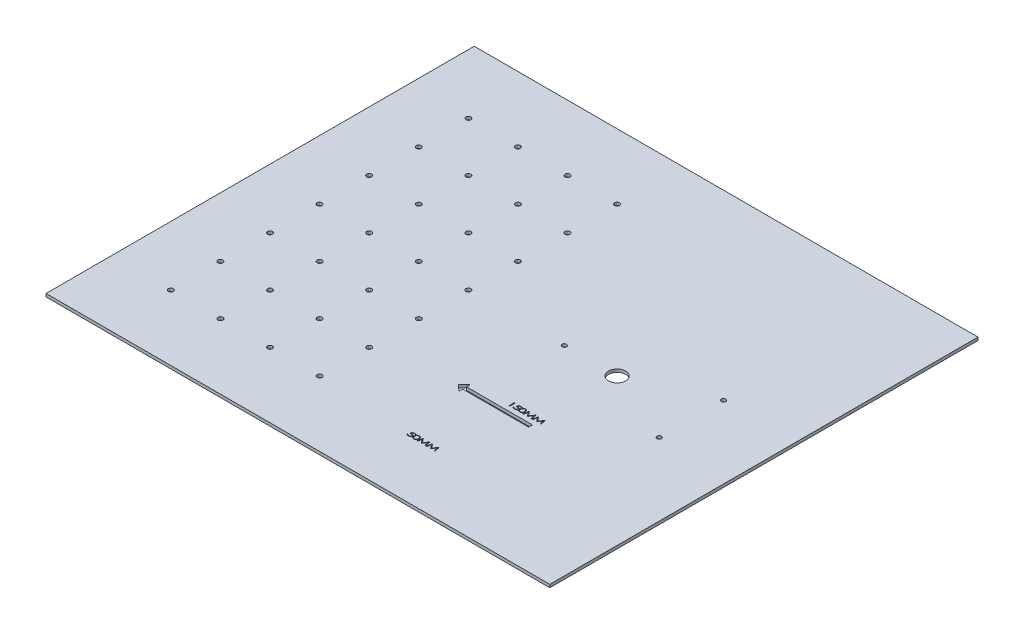
from build123d import *

# Parameters (mm, degrees)
SKETCH1_W                = 508
SKETCH1_H                = 431.8
BOSS_EXTRUDE1_DEPTH      = 3
SKETCH3_R                = 2.25
SKETCH3_R_2              = 8.65
CUT_EXTRUDE1_DEPTH       = 334.373379261
SKETCH4_R                = 2.5
CUT_EXTRUDE2_DEPTH       = 334.373379261
LPATTERN1_COUNT          = 4
LPATTERN1_PITCH          = 50
LPATTERN1_COUNT_DIR2     = 4
LPATTERN1_PITCH_DIR2     = 50
MIRROR1_COPY_1_SKETCH_R  = 2.5
MIRROR1_COPY_1_DEPTH     = 334.373379261
MIRROR1_COPY_2_SKETCH_R  = 2.5
MIRROR1_COPY_2_DEPTH     = 334.373379261
MIRROR1_COPY_3_SKETCH_R  = 2.5
MIRROR1_COPY_3_DEPTH     = 334.373379261
MIRROR1_COPY_4_SKETCH_R  = 2.5
MIRROR1_COPY_4_DEPTH     = 334.373379261
MIRROR1_COPY_5_SKETCH_R  = 2.5
MIRROR1_COPY_5_DEPTH     = 334.373379261
MIRROR1_COPY_6_SKETCH_R  = 2.5
MIRROR1_COPY_6_DEPTH     = 334.373379261
MIRROR1_COPY_7_SKETCH_R  = 2.5
MIRROR1_COPY_7_DEPTH     = 334.373379261
MIRROR1_COPY_8_SKETCH_R  = 2.5
MIRROR1_COPY_8_DEPTH     = 334.373379261
MIRROR1_COPY_9_SKETCH_R  = 2.5
MIRROR1_COPY_9_DEPTH     = 334.373379261
MIRROR1_COPY_10_SKETCH_R = 2.5
MIRROR1_COPY_10_DEPTH    = 334.373379261
MIRROR1_COPY_11_SKETCH_R = 2.5
MIRROR1_COPY_11_DEPTH    = 334.373379261
MIRROR1_COPY_12_SKETCH_R = 2.5
MIRROR1_COPY_12_DEPTH    = 334.373379261
MIRROR1_COPY_13_SKETCH_R = 2.5
MIRROR1_COPY_13_DEPTH    = 334.373379261
MIRROR1_COPY_14_SKETCH_R = 2.5
MIRROR1_COPY_14_DEPTH    = 334.373379261
MIRROR1_COPY_15_SKETCH_R = 2.5
MIRROR1_COPY_15_DEPTH    = 334.373379261
MIRROR1_COPY_16_SKETCH_R = 2.5
MIRROR1_COPY_16_DEPTH    = 334.373379261
CUT_EXTRUDE3_DEPTH       = 334.373379261


with BuildPart() as part:
    # Sketch1 → Boss-Extrude1 (new body)
    with BuildSketch(Plane(origin=(0, 0, 0), x_dir=(1, 0, 0), z_dir=(0, 1, 0))):
        Rectangle(SKETCH1_W, SKETCH1_H)
    extrude(amount=BOSS_EXTRUDE1_DEPTH)

    # Sketch3 → Cut-Extrude1 (cut, through all)
    with BuildSketch(Plane(origin=(0, 3, 0), x_dir=(1, 0, 0), z_dir=(0, 1, 0))):
        with Locations(Location((180.936115746, -32.430740144, 0), (0, 0, 270))):
            Circle(SKETCH3_R)
        with Locations(Location((180.936115746, 32.430740144, 0), (0, 0, 270))):
            Circle(SKETCH3_R)
        with Locations(Location((52.812916669, 0, 0), (0, 0, 270))):
            Circle(SKETCH3_R)
        with Locations(Location((106, 0, 0), (0, 0, 270))):
            Circle(SKETCH3_R_2)
    extrude(amount=-CUT_EXTRUDE1_DEPTH, mode=Mode.SUBTRACT)

    # Sketch4 → Cut-Extrude2 (cut, through all)
    with BuildSketch(Plane(origin=(0, 3, 0), x_dir=(1, 0, 0), z_dir=(0, 1, 0))):
        with Locations(Location((-44, 0, 0), (0, 0, 270))):
            Circle(SKETCH4_R)
    cut_extrude2 = extrude(amount=-CUT_EXTRUDE2_DEPTH, mode=Mode.SUBTRACT)

    # LPattern1: Cut-Extrude2 4 × 4
    with Locations(*[(-j * LPATTERN1_PITCH_DIR2, 0, -i * LPATTERN1_PITCH) for i in range(LPATTERN1_COUNT) for j in range(LPATTERN1_COUNT_DIR2) if (i, j) != (0, 0)]):
        add(cut_extrude2, mode=Mode.SUBTRACT)

    # Mirror1 copy 1 sketch → Mirror1 copy 1 (cut, through all)
    with BuildSketch(Plane(origin=(-50, 3, 0), x_dir=(1, 0, 0), z_dir=(0, 1, 0))):
        with Locations((-44, 0)):
            Circle(MIRROR1_COPY_1_SKETCH_R)
    extrude(amount=-MIRROR1_COPY_1_DEPTH, mode=Mode.SUBTRACT)

    # Mirror1 copy 2 sketch → Mirror1 copy 2 (cut, through all)
    with BuildSketch(Plane(origin=(-100, 3, 0), x_dir=(1, 0, 0), z_dir=(0, 1, 0))):
        with Locations((-44, 0)):
            Circle(MIRROR1_COPY_2_SKETCH_R)
    extrude(amount=-MIRROR1_COPY_2_DEPTH, mode=Mode.SUBTRACT)

    # Mirror1 copy 3 sketch → Mirror1 copy 3 (cut, through all)
    with BuildSketch(Plane(origin=(-150, 3, 0), x_dir=(1, 0, 0), z_dir=(0, 1, 0))):
        with Locations((-44, 0)):
            Circle(MIRROR1_COPY_3_SKETCH_R)
    extrude(amount=-MIRROR1_COPY_3_DEPTH, mode=Mode.SUBTRACT)

    # Mirror1 copy 4 sketch → Mirror1 copy 4 (cut, through all)
    with BuildSketch(Plane(origin=(0, 3, 50), x_dir=(1, 0, 0), z_dir=(0, 1, 0))):
        with Locations((-44, 0)):
            Circle(MIRROR1_COPY_4_SKETCH_R)
    extrude(amount=-MIRROR1_COPY_4_DEPTH, mode=Mode.SUBTRACT)

    # Mirror1 copy 5 sketch → Mirror1 copy 5 (cut, through all)
    with BuildSketch(Plane(origin=(-50, 3, 50), x_dir=(1, 0, 0), z_dir=(0, 1, 0))):
        with Locations((-44, 0)):
            Circle(MIRROR1_COPY_5_SKETCH_R)
    extrude(amount=-MIRROR1_COPY_5_DEPTH, mode=Mode.SUBTRACT)

    # Mirror1 copy 6 sketch → Mirror1 copy 6 (cut, through all)
    with BuildSketch(Plane(origin=(-100, 3, 50), x_dir=(1, 0, 0), z_dir=(0, 1, 0))):
        with Locations((-44, 0)):
            Circle(MIRROR1_COPY_6_SKETCH_R)
    extrude(amount=-MIRROR1_COPY_6_DEPTH, mode=Mode.SUBTRACT)

    # Mirror1 copy 7 sketch → Mirror1 copy 7 (cut, through all)
    with BuildSketch(Plane(origin=(-150, 3, 50), x_dir=(1, 0, 0), z_dir=(0, 1, 0))):
        with Locations((-44, 0)):
            Circle(MIRROR1_COPY_7_SKETCH_R)
    extrude(amount=-MIRROR1_COPY_7_DEPTH, mode=Mode.SUBTRACT)

    # Mirror1 copy 8 sketch → Mirror1 copy 8 (cut, through all)
    with BuildSketch(Plane(origin=(0, 3, 100), x_dir=(1, 0, 0), z_dir=(0, 1, 0))):
        with Locations((-44, 0)):
            Circle(MIRROR1_COPY_8_SKETCH_R)
    extrude(amount=-MIRROR1_COPY_8_DEPTH, mode=Mode.SUBTRACT)

    # Mirror1 copy 9 sketch → Mirror1 copy 9 (cut, through all)
    with BuildSketch(Plane(origin=(-50, 3, 100), x_dir=(1, 0, 0), z_dir=(0, 1, 0))):
        with Locations((-44, 0)):
            Circle(MIRROR1_COPY_9_SKETCH_R)
    extrude(amount=-MIRROR1_COPY_9_DEPTH, mode=Mode.SUBTRACT)

    # Mirror1 copy 10 sketch → Mirror1 copy 10 (cut, through all)
    with BuildSketch(Plane(origin=(-100, 3, 100), x_dir=(1, 0, 0), z_dir=(0, 1, 0))):
        with Locations((-44, 0)):
            Circle(MIRROR1_COPY_10_SKETCH_R)
    extrude(amount=-MIRROR1_COPY_10_DEPTH, mode=Mode.SUBTRACT)

    # Mirror1 copy 11 sketch → Mirror1 copy 11 (cut, through all)
    with BuildSketch(Plane(origin=(-150, 3, 100), x_dir=(1, 0, 0), z_dir=(0, 1, 0))):
        with Locations((-44, 0)):
            Circle(MIRROR1_COPY_11_SKETCH_R)
    extrude(amount=-MIRROR1_COPY_11_DEPTH, mode=Mode.SUBTRACT)

    # Mirror1 copy 12 sketch → Mirror1 copy 12 (cut, through all)
    with BuildSketch(Plane(origin=(0, 3, 150), x_dir=(1, 0, 0), z_dir=(0, 1, 0))):
        with Locations((-44, 0)):
            Circle(MIRROR1_COPY_12_SKETCH_R)
    extrude(amount=-MIRROR1_COPY_12_DEPTH, mode=Mode.SUBTRACT)

    # Mirror1 copy 13 sketch → Mirror1 copy 13 (cut, through all)
    with BuildSketch(Plane(origin=(-50, 3, 150), x_dir=(1, 0, 0), z_dir=(0, 1, 0))):
        with Locations((-44, 0)):
            Circle(MIRROR1_COPY_13_SKETCH_R)
    extrude(amount=-MIRROR1_COPY_13_DEPTH, mode=Mode.SUBTRACT)

    # Mirror1 copy 14 sketch → Mirror1 copy 14 (cut, through all)
    with BuildSketch(Plane(origin=(-100, 3, 150), x_dir=(1, 0, 0), z_dir=(0, 1, 0))):
        with Locations((-44, 0)):
            Circle(MIRROR1_COPY_14_SKETCH_R)
    extrude(amount=-MIRROR1_COPY_14_DEPTH, mode=Mode.SUBTRACT)

    # Mirror1 copy 15 sketch → Mirror1 copy 15 (cut, through all)
    with BuildSketch(Plane(origin=(-150, 3, 150), x_dir=(1, 0, 0), z_dir=(0, 1, 0))):
        with Locations((-44, 0)):
            Circle(MIRROR1_COPY_15_SKETCH_R)
    extrude(amount=-MIRROR1_COPY_15_DEPTH, mode=Mode.SUBTRACT)

    # Mirror1 copy 16 sketch → Mirror1 copy 16 (cut, through all)
    with BuildSketch(Plane(origin=(0, 3, 0), x_dir=(1, 0, 0), z_dir=(0, 1, 0))):
        with Locations((-44, 0)):
            Circle(MIRROR1_COPY_16_SKETCH_R)
    extrude(amount=-MIRROR1_COPY_16_DEPTH, mode=Mode.SUBTRACT)

    # Sketch5 → Cut-Extrude3 (cut, through all)
    # profile 1 of 10: a face of its own
    with BuildSketch(Plane(origin=(0, 3, 0), x_dir=(1, 0, 0), z_dir=(0, 1, 0))):
        Polygon((106, -85.434687604), (39.587582854, -85.434687604), (39.587582854, -81.781861558), (33.181549807, -87.362208873), (39.587582854, -92.942556188), (39.587582854, -89.289730142), (106, -89.289730142), align=None)
    # profile 2 of 10: a face of its own
    with BuildSketch(Plane(origin=(0, 3, 0), x_dir=(1, 0, 0), z_dir=(0, 1, 0))):
        Polygon((76.805592119, -75.174104307), (78.307653751, -75.174104307), (78.307653751, -80.465770973), (77.561393067, -80.465770973), (77.561393067, -75.71683935), (76.340239221, -75.71683935), align=None)
    # profile 3 of 10: a face of its own
    with BuildSketch(Plane(origin=(0, 3, 0), x_dir=(1, 0, 0), z_dir=(0, 1, 0))):
        with BuildLine():
            Line((85.444619563, -75.174104307), (85.444619563, -75.71683935))
            Line((85.444619563, -75.71683935), (82.851787699, -75.71683935))
            Line((82.851787699, -75.71683935), (82.42141577, -77.115018102))
            add(Edge.make_bspline(
                [(82.42141577, -77.115018102), (82.502176069, -77.098233974), (82.659183031, -77.065603769), (82.89037466, -77.032679424), (83.108893952, -77.009274638), (83.250655477, -77.006956792), (83.319260656, -77.005835076)],
                knots=[0, 0, 0, 0, 1.092118873, 2.123200014, 3.091726778, 4, 4, 4, 4], degree=3))
            add(Edge.make_bspline(
                [(83.319260656, -77.005835076), (83.404475853, -77.007082747), (83.571001681, -77.00952092), (83.814967085, -77.033764907), (84.047720512, -77.071485542), (84.269292681, -77.124204462), (84.479489729, -77.191829672), (84.677397342, -77.276321871), (84.864890599, -77.374604986), (85.038778202, -77.488750232), (85.19682443, -77.61377353), (85.336730835, -77.747300692), (85.452426342, -77.89181626), (85.549667908, -78.04320536), (85.624197521, -78.204525401), (85.677328937, -78.374448872), (85.710171211, -78.552919348), (85.714027546, -78.674887039), (85.715987085, -78.736863054)],
                knots=[0, 0, 0, 0, 1.242117267, 2.427320619, 3.570715956, 4.677834446, 5.74496214, 6.786054724, 7.811581669, 8.827539835, 9.813966018, 10.74666266, 11.64056272, 12.506685079, 13.364137757, 14.222827697, 15.096957098, 16, 16, 16, 16], degree=3))
            add(Edge.make_bspline(
                [(85.715987085, -78.736863054), (85.715074659, -78.780031216), (85.713257584, -78.865999699), (85.695370645, -78.993270385), (85.668125209, -79.118280658), (85.628527109, -79.240164045), (85.578553647, -79.359310779), (85.517665459, -79.475684685), (85.445184932, -79.589398304), (85.361826775, -79.699599885), (85.269743993, -79.80586396), (85.168733666, -79.905371573), (85.060359802, -79.998837186), (84.944388269, -80.086236286), (84.820150662, -80.166507234), (84.688243937, -80.241102896), (84.548221935, -80.308669632), (84.400597646, -80.370041706), (84.246570901, -80.425362791), (84.085862404, -80.471308872), (83.920183183, -80.51215005), (83.748187556, -80.544741786), (83.56991821, -80.570282239), (83.385588637, -80.587572543), (83.195767454, -80.600287902), (83.067349195, -80.60106246), (83.002311871, -80.601454734)],
                knots=[0, 0, 0, 0, 0.849737757, 1.692234802, 2.526325876, 3.367039004, 4.212319464, 5.068331996, 5.950617473, 6.865060235, 7.787491851, 8.71755737, 9.655065502, 10.604304333, 11.575234203, 12.566184335, 13.587081016, 14.635246973, 15.713814051, 16.808360441, 17.925743583, 19.073593279, 20.254612328, 21.471282493, 22.71933306, 24, 24, 24, 24], degree=3))
            add(Edge.make_bspline(
                [(83.002311871, -80.601454734), (82.924875094, -80.600423839), (82.772908537, -80.598400748), (82.549690976, -80.576855614), (82.335510278, -80.546496241), (82.130962114, -80.500119417), (81.935083544, -80.442319614), (81.74894806, -80.370003518), (81.571339863, -80.286109853), (81.404882343, -80.188967822), (81.250845137, -80.081748001), (81.112136408, -79.966075213), (80.990160716, -79.842008693), (80.884086742, -79.710836844), (80.793594151, -79.571992004), (80.721809778, -79.424650826), (80.664354895, -79.270286359), (80.640075392, -79.162981638), (80.627846059, -79.108933367)],
                knots=[0, 0, 0, 0, 1.222351999, 2.398816573, 3.538221509, 4.636007424, 5.707503499, 6.76022681, 7.785945612, 8.806049581, 9.799750817, 10.74629781, 11.653739019, 12.542532424, 13.40610013, 14.264461216, 15.125827183, 16, 16, 16, 16], degree=3))
            Line((80.627846059, -79.108933367), (81.374106743, -79.108933367))
            add(Edge.make_bspline(
                [(81.374106743, -79.108933367), (81.390717854, -79.159668992), (81.423086302, -79.258532548), (81.494637848, -79.395175747), (81.581982044, -79.516608393), (81.685461419, -79.62490364), (81.807602501, -79.718401599), (81.946856077, -79.802352686), (82.103732847, -79.877316213), (82.277107846, -79.940891625), (82.461145887, -79.993880818), (82.652858183, -80.029993371), (82.848306979, -80.054920116), (82.980325454, -80.057446807), (83.046833105, -80.058719691)],
                knots=[0, 0, 0, 0, 0.92978215, 1.811775602, 2.677143603, 3.531381573, 4.413977597, 5.351406713, 6.362954654, 7.441227563, 8.568721348, 9.698721555, 10.840672695, 12, 12, 12, 12], degree=3))
            add(Edge.make_bspline(
                [(83.046833105, -80.058719691), (83.111541712, -80.057481597), (83.238739793, -80.055047868), (83.426024429, -80.036331355), (83.606585174, -80.007570519), (83.779741931, -79.964065277), (83.947149551, -79.912357255), (84.105895796, -79.84442782), (84.258823152, -79.767190347), (84.402274479, -79.677901497), (84.534404882, -79.580352707), (84.650850221, -79.475469535), (84.749087847, -79.363762417), (84.829677648, -79.245995241), (84.892884446, -79.122508631), (84.937804393, -78.992713023), (84.965282954, -78.856748129), (84.968231024, -78.763846063), (84.969726401, -78.716722496)],
                knots=[0, 0, 0, 0, 1.197710496, 2.354346425, 3.481358772, 4.579234483, 5.657049875, 6.721281669, 7.771530174, 8.826169641, 9.845319705, 10.808521165, 11.721713464, 12.59259801, 13.443904033, 14.281733402, 15.128427861, 16, 16, 16, 16], degree=3))
            add(Edge.make_bspline(
                [(84.969726401, -78.716722496), (84.968552755, -78.674188451), (84.966243609, -78.590502836), (84.940439378, -78.468708939), (84.901254394, -78.353213174), (84.846520315, -78.243367006), (84.774753117, -78.140233291), (84.686950777, -78.043640494), (84.58432487, -77.952858532), (84.466461565, -77.870087435), (84.336516573, -77.793446887), (84.194205279, -77.728156458), (84.041400766, -77.673487903), (83.878945123, -77.625796236), (83.704894878, -77.592198724), (83.520961763, -77.566335057), (83.326562434, -77.551751327), (83.193493454, -77.549648261), (83.125275279, -77.548570119)],
                knots=[0, 0, 0, 0, 0.839989002, 1.652676055, 2.450444587, 3.247355699, 4.071172904, 4.927170814, 5.823193115, 6.775259186, 7.771218823, 8.802988954, 9.866295139, 10.978797271, 12.147804939, 13.368311782, 14.650857869, 16, 16, 16, 16], degree=3))
            add(Edge.make_bspline(
                [(83.125275279, -77.548570119), (83.065893125, -77.54943581), (82.943821779, -77.551215404), (82.75639704, -77.564636832), (82.559825574, -77.58595433), (82.354087622, -77.615867069), (82.138830299, -77.654201937), (81.914385607, -77.700930499), (81.680741639, -77.756089518), (81.522760178, -77.798330367), (81.441948623, -77.81993764)],
                knots=[0, 0, 0, 0, 0.833456271, 1.713328363, 2.636208637, 3.608349397, 4.630866269, 5.704717881, 6.825904535, 8, 8, 8, 8], degree=3))
            Line((81.441948623, -77.81993764), (82.256051187, -75.174104307))
            Line((82.256051187, -75.174104307), (85.444619563, -75.174104307))
        make_face()
    # profile 4 of 10: a face of its own
    with BuildSketch(Plane(origin=(0, 3, 0), x_dir=(1, 0, 0), z_dir=(0, 1, 0))):
        with BuildLine():
            add(Edge.make_bspline(
                [(85.865239221, -77.822057699), (85.866326234, -77.737237383), (85.868438591, -77.572408859), (85.882762456, -77.332099107), (85.909317651, -77.106763565), (85.945245991, -76.896204432), (85.989817483, -76.7002393), (86.047557078, -76.519825966), (86.113694879, -76.353404753), (86.191872942, -76.201583625), (86.28006287, -76.062394049), (86.373821968, -75.930847405), (86.478915284, -75.809970612), (86.590725625, -75.696508408), (86.711435786, -75.591766593), (86.84059289, -75.496635348), (86.978675103, -75.410309164), (87.124106821, -75.332122545), (87.276859274, -75.263881693), (87.433747951, -75.203069719), (87.595516443, -75.151922112), (87.761764374, -75.111254294), (87.93214895, -75.077717321), (88.107047562, -75.054831566), (88.28645826, -75.040556433), (88.407515832, -75.039137406), (88.468671379, -75.038420546)],
                knots=[0, 0, 0, 0, 1.403735188, 2.727832326, 3.981926955, 5.156703579, 6.261657675, 7.30470138, 8.288511526, 9.222174616, 10.125912193, 11.013712278, 11.892803487, 12.773546302, 13.648211464, 14.534739601, 15.425462113, 16.341134147, 17.265003812, 18.192419874, 19.124525132, 20.070504313, 21.023524123, 21.996921438, 22.988090027, 24, 24, 24, 24], degree=3))
            add(Edge.make_bspline(
                [(88.468671379, -75.038420546), (88.530886021, -75.039134153), (88.653706619, -75.040542914), (88.835599424, -75.054781274), (89.013254919, -75.07799772), (89.186266523, -75.110782929), (89.355146804, -75.15227538), (89.519417761, -75.203139429), (89.679576525, -75.263350441), (89.834052994, -75.333565133), (89.983279294, -75.4113893), (90.123972115, -75.501053668), (90.257757432, -75.598397453), (90.38390747, -75.704664055), (90.500117988, -75.821669651), (90.60890701, -75.947381866), (90.709638705, -76.082490006), (90.803378488, -76.226766115), (90.888021415, -76.38213072), (90.959611697, -76.55068345), (91.021421847, -76.731243789), (91.070548476, -76.924950042), (91.110161547, -77.131244102), (91.136628342, -77.350504428), (91.15440333, -77.582197094), (91.156057607, -77.740753181), (91.156905888, -77.822057699)],
                knots=[0, 0, 0, 0, 1.018497111, 2.010658934, 2.985171915, 3.950782843, 4.892314633, 5.831069457, 6.764837193, 7.691805427, 8.607950246, 9.518028483, 10.420628394, 11.315481803, 12.215482162, 13.117859548, 14.035428116, 14.972594959, 15.932992342, 16.928152097, 17.967340052, 19.054830013, 20.197432436, 21.404424431, 22.669038684, 24, 24, 24, 24], degree=3))
            add(Edge.make_bspline(
                [(91.156905888, -77.822057699), (91.156049845, -77.903007664), (91.15438061, -78.060855577), (91.136718381, -78.291508703), (91.109866817, -78.509579609), (91.071650448, -78.714898767), (91.023568527, -78.90756168), (90.962505276, -79.087269914), (90.892641061, -79.255431743), (90.808394032, -79.409502504), (90.717360516, -79.553832019), (90.615856081, -79.687196504), (90.50766299, -79.813018398), (90.390951337, -79.92983175), (90.265554467, -80.037321597), (90.131351066, -80.134546698), (89.990003841, -80.224587639), (89.839643358, -80.303447337), (89.68297176, -80.372487308), (89.522616519, -80.43529137), (89.357035968, -80.485025039), (89.187834351, -80.528251928), (89.013959084, -80.560931458), (88.835891291, -80.583606116), (88.653763721, -80.599708907), (88.530895867, -80.600867821), (88.468671379, -80.601454734)],
                knots=[0, 0, 0, 0, 1.326075422, 2.585773043, 3.787839099, 4.924453812, 6.005635817, 7.038185798, 8.031745612, 8.984949921, 9.91162458, 10.825185772, 11.728174756, 12.628785101, 13.52799879, 14.431210449, 15.341905503, 16.271613356, 17.209772702, 18.146233535, 19.091156401, 20.040343789, 21.006609171, 21.987522684, 22.98081259, 24, 24, 24, 24], degree=3))
            add(Edge.make_bspline(
                [(88.468671379, -80.601454734), (88.407517694, -80.60072584), (88.286463807, -80.599282991), (88.107375479, -80.585210131), (87.932986374, -80.561763059), (87.763190003, -80.529810477), (87.597451585, -80.490367567), (87.437156456, -80.438626272), (87.281083107, -80.379273245), (87.129438891, -80.311960777), (86.984587978, -80.234694524), (86.847132778, -80.14878096), (86.718342897, -80.053180694), (86.598843233, -79.94757523), (86.485601169, -79.834885509), (86.380251032, -79.713208033), (86.285353409, -79.580686785), (86.196100831, -79.440430675), (86.11695331, -79.287533532), (86.049374779, -79.120284764), (85.992385147, -78.938706464), (85.946449605, -78.742999252), (85.908589501, -78.533306696), (85.88466297, -78.308693491), (85.867942205, -78.070003828), (85.866156337, -77.906185155), (85.865239221, -77.822057699)],
                knots=[0, 0, 0, 0, 1.013144154, 2.005521627, 2.974303058, 3.927388906, 4.867438012, 5.795098794, 6.716084338, 7.633340424, 8.542205853, 9.434014739, 10.316919509, 11.196498533, 12.074165892, 12.962585908, 13.859645169, 14.772555999, 15.715245058, 16.707881558, 17.757778926, 18.865427691, 20.036877205, 21.286014602, 22.606259698, 24, 24, 24, 24], degree=3))
        make_face()
        with BuildLine():
            add(Edge.make_bspline(
                [(86.611499905, -77.81993764), (86.611859612, -77.890627686), (86.612557984, -78.027872533), (86.625099629, -78.227254595), (86.642202972, -78.413392137), (86.667506161, -78.586131875), (86.700590933, -78.745253484), (86.73865307, -78.892090824), (86.786654642, -79.024774832), (86.841191254, -79.145343793), (86.903203183, -79.255482225), (86.97269585, -79.357379174), (87.047681512, -79.453413864), (87.131054272, -79.541724433), (87.221361086, -79.623233969), (87.317772238, -79.698788154), (87.421425041, -79.76696936), (87.567842923, -79.848130128), (87.759320891, -79.932398719), (87.998069603, -80.004991824), (88.243303713, -80.050085526), (88.409473935, -80.055830274), (88.493052055, -80.058719691)],
                knots=[0, 0, 0, 0, 1.269842302, 2.465401057, 3.587936749, 4.627618279, 5.600016604, 6.50705226, 7.350471098, 8.131749073, 8.882188722, 9.618203836, 10.345958755, 11.06904675, 11.797161553, 12.529911266, 13.267676586, 14.023654412, 15.535876607, 17.015948128, 18.499120702, 20, 20, 20, 20], degree=3))
            add(Edge.make_bspline(
                [(88.493052055, -80.058719691), (88.577365808, -80.056394549), (88.743972291, -80.051799997), (88.988693316, -80.005309012), (89.225691524, -79.93668917), (89.413930903, -79.85283142), (89.557234793, -79.77329872), (89.659132067, -79.706263152), (89.75308363, -79.630568607), (89.841332194, -79.549127819), (89.922878345, -79.460380957), (89.996364021, -79.363642463), (90.065321906, -79.26092778), (90.103894868, -79.187407849), (90.123377242, -79.150274512)],
                knots=[0, 0, 0, 0, 1.541520505, 3.046090383, 4.543945575, 6.049668695, 6.805351412, 7.542571016, 8.278882295, 9.011092164, 9.738918961, 10.481424375, 11.23300009, 12, 12, 12, 12], degree=3))
            add(Edge.make_bspline(
                [(90.123377242, -79.150274512), (90.146700792, -79.103248834), (90.193648969, -79.008590437), (90.251719313, -78.859218684), (90.300172245, -78.703199919), (90.340506295, -78.540387762), (90.372563604, -78.37056961), (90.394120787, -78.193151546), (90.408612996, -78.008864647), (90.409960757, -77.883568246), (90.410645204, -77.81993764)],
                knots=[0, 0, 0, 0, 0.916501938, 1.844834726, 2.795466895, 3.768435452, 4.773126038, 5.811927813, 6.888807996, 8, 8, 8, 8], degree=3))
            add(Edge.make_bspline(
                [(90.410645204, -77.81993764), (90.409753356, -77.756321678), (90.408007768, -77.631807978), (90.396664385, -77.449549939), (90.376103579, -77.276303174), (90.34960663, -77.111381979), (90.311690134, -76.956034981), (90.268861741, -76.808712924), (90.216920263, -76.670425311), (90.156097906, -76.541226167), (90.089769298, -76.420080887), (90.015908706, -76.308073634), (89.936508091, -76.20434777), (89.851588732, -76.107826237), (89.759043723, -76.02133287), (89.66121263, -75.942210836), (89.556940065, -75.871960133), (89.410421373, -75.791105011), (89.219744542, -75.707845142), (88.983740822, -75.633427958), (88.74021226, -75.590121173), (88.575900729, -75.584160874), (88.493052055, -75.581155589)],
                knots=[0, 0, 0, 0, 1.143048628, 2.237256344, 3.279101487, 4.276898645, 5.236246244, 6.150216925, 7.03222975, 7.887138624, 8.714055636, 9.511721569, 10.295188532, 11.05967358, 11.818682171, 12.568259394, 13.318374141, 14.07437643, 15.572468509, 17.048388297, 18.51174707, 20, 20, 20, 20], degree=3))
            add(Edge.make_bspline(
                [(88.493052055, -75.581155589), (88.408792993, -75.584155119), (88.242027493, -75.590091789), (87.99563325, -75.633169677), (87.758115868, -75.707565721), (87.567792832, -75.79116658), (87.422127802, -75.87058445), (87.319888966, -75.93945636), (87.223491547, -76.013747199), (87.135286209, -76.096797881), (87.05184007, -76.18424461), (86.976908762, -76.280371689), (86.907540789, -76.382535445), (86.844405142, -76.492360154), (86.788461188, -76.612704275), (86.7413826, -76.745582399), (86.700846443, -76.891847407), (86.66908039, -77.051782551), (86.641909346, -77.224607328), (86.625107234, -77.411218675), (86.612545359, -77.610939719), (86.611855286, -77.748893042), (86.611499905, -77.81993764)],
                knots=[0, 0, 0, 0, 1.513772308, 2.996057509, 4.478206715, 5.976466197, 6.723919043, 7.456499242, 8.189354548, 8.90821345, 9.631405645, 10.359265438, 11.095386615, 11.849070134, 12.633113281, 13.47665366, 14.379365024, 15.358122331, 16.405178713, 17.521556336, 18.723626006, 20, 20, 20, 20], degree=3))
        make_face(mode=Mode.SUBTRACT)
    # profile 5 of 10: a face of its own
    with BuildSketch(Plane(origin=(0, 3, 0), x_dir=(1, 0, 0), z_dir=(0, 1, 0))):
        Polygon((91.509683666, -80.465770973), (92.585613487, -75.174104307), (92.763698423, -75.174104307), (95.953326828, -79.515984649), (99.133414969, -75.174104307), (99.317860081, -75.174104307), (100.396969991, -80.465770973), (99.64540916, -80.465770973), (98.870527683, -76.666625674), (96.087950559, -80.465770973), (95.827183332, -80.465770973), (93.036125973, -76.666625674), (92.263364555, -80.465770973), align=None)
    # profile 6 of 10: a face of its own
    with BuildSketch(Plane(origin=(0, 3, 0), x_dir=(1, 0, 0), z_dir=(0, 1, 0))):
        Polygon((100.885431529, -80.465770973), (101.96136135, -75.174104307), (102.139446286, -75.174104307), (105.329074691, -79.515984649), (108.509162832, -75.174104307), (108.693607945, -75.174104307), (109.772717854, -80.465770973), (109.021157023, -80.465770973), (108.246275546, -76.666625674), (105.463698423, -80.465770973), (105.202931195, -80.465770973), (102.411873837, -76.666625674), (101.639112418, -80.465770973), align=None)
    # profile 7 of 10: a face of its own
    with BuildSketch(Plane(origin=(0, 3, 0), x_dir=(1, 0, 0), z_dir=(0, 1, 0))):
        with BuildLine():
            Line((55.51734204, -152.150859843), (55.51734204, -152.693594886))
            Line((55.51734204, -152.693594886), (52.924510176, -152.693594886))
            Line((52.924510176, -152.693594886), (52.494138247, -154.091773639))
            add(Edge.make_bspline(
                [(52.494138247, -154.091773639), (52.574898546, -154.07498951), (52.731905508, -154.042359306), (52.963097136, -154.00943496), (53.181616429, -153.986030174), (53.323377954, -153.983712329), (53.391983132, -153.982590612)],
                knots=[0, 0, 0, 0, 1.092118873, 2.123200014, 3.091726778, 4, 4, 4, 4], degree=3))
            add(Edge.make_bspline(
                [(53.391983132, -153.982590612), (53.47719833, -153.983838283), (53.643724158, -153.986276457), (53.887689562, -154.010520444), (54.120442989, -154.048241079), (54.342015158, -154.100959998), (54.552212205, -154.168585208), (54.750119819, -154.253077407), (54.937613076, -154.351360522), (55.111500679, -154.465505768), (55.269546906, -154.590529067), (55.409453311, -154.724056228), (55.525148819, -154.868571796), (55.622390385, -155.019960897), (55.696919998, -155.181280937), (55.750051414, -155.351204408), (55.782893687, -155.529674885), (55.786750023, -155.651642575), (55.788709561, -155.713618591)],
                knots=[0, 0, 0, 0, 1.242117267, 2.427320619, 3.570715956, 4.677834446, 5.74496214, 6.786054724, 7.811581669, 8.827539835, 9.813966018, 10.74666266, 11.64056272, 12.506685079, 13.364137757, 14.222827697, 15.096957098, 16, 16, 16, 16], degree=3))
            add(Edge.make_bspline(
                [(55.788709561, -155.713618591), (55.787797136, -155.756786752), (55.78598006, -155.842755235), (55.768093122, -155.970025922), (55.740847686, -156.095036195), (55.701249586, -156.216919582), (55.651276123, -156.336066315), (55.590387936, -156.452440222), (55.517907409, -156.566153841), (55.434549252, -156.676355421), (55.34246647, -156.782619496), (55.241456142, -156.88212711), (55.133082279, -156.975592722), (55.017110746, -157.062991822), (54.892873138, -157.14326277), (54.760966413, -157.217858432), (54.620944412, -157.285425169), (54.473320122, -157.346797242), (54.319293378, -157.402118327), (54.158584881, -157.448064408), (53.99290566, -157.488905586), (53.820910033, -157.521497323), (53.642640687, -157.547037776), (53.458311114, -157.564328079), (53.268489931, -157.577043438), (53.140071671, -157.577817996), (53.075034348, -157.578210271)],
                knots=[0, 0, 0, 0, 0.849737757, 1.692234802, 2.526325876, 3.367039004, 4.212319464, 5.068331996, 5.950617473, 6.865060235, 7.787491851, 8.71755737, 9.655065502, 10.604304333, 11.575234203, 12.566184335, 13.587081016, 14.635246973, 15.713814051, 16.808360441, 17.925743583, 19.073593279, 20.254612328, 21.471282493, 22.71933306, 24, 24, 24, 24], degree=3))
            add(Edge.make_bspline(
                [(53.075034348, -157.578210271), (52.997597571, -157.577179375), (52.845631014, -157.575156285), (52.622413453, -157.553611151), (52.408232755, -157.523251777), (52.203684591, -157.476874953), (52.007806021, -157.419075151), (51.821670536, -157.346759054), (51.644062339, -157.26286539), (51.47760482, -157.165723358), (51.323567614, -157.058503538), (51.184858885, -156.942830749), (51.062883193, -156.818764229), (50.956809219, -156.687592381), (50.866316628, -156.548747541), (50.794532255, -156.401406362), (50.737077372, -156.247041895), (50.712797869, -156.139737174), (50.700568536, -156.085688903)],
                knots=[0, 0, 0, 0, 1.222351999, 2.398816573, 3.538221509, 4.636007424, 5.707503499, 6.76022681, 7.785945612, 8.806049581, 9.799750817, 10.74629781, 11.653739019, 12.542532424, 13.40610013, 14.264461216, 15.125827183, 16, 16, 16, 16], degree=3))
            Line((50.700568536, -156.085688903), (51.446829219, -156.085688903))
            add(Edge.make_bspline(
                [(51.446829219, -156.085688903), (51.46344033, -156.136424529), (51.495808779, -156.235288084), (51.567360325, -156.371931284), (51.654704521, -156.49336393), (51.758183896, -156.601659177), (51.880324978, -156.695157136), (52.019578554, -156.779108223), (52.176455323, -156.85407175), (52.349830323, -156.917647162), (52.533868363, -156.970636354), (52.72558066, -157.006748907), (52.921029456, -157.031675652), (53.053047931, -157.034202343), (53.119555582, -157.035475228)],
                knots=[0, 0, 0, 0, 0.92978215, 1.811775602, 2.677143603, 3.531381573, 4.413977597, 5.351406713, 6.362954654, 7.441227563, 8.568721348, 9.698721555, 10.840672695, 12, 12, 12, 12], degree=3))
            add(Edge.make_bspline(
                [(53.119555582, -157.035475228), (53.184264188, -157.034237134), (53.311462269, -157.031803404), (53.498746906, -157.013086892), (53.679307651, -156.984326055), (53.852464408, -156.940820814), (54.019872027, -156.889112792), (54.178618273, -156.821183356), (54.331545629, -156.743945883), (54.474996956, -156.654657034), (54.607127359, -156.557108244), (54.723572697, -156.452225071), (54.821810324, -156.340517953), (54.902400125, -156.222750777), (54.965606923, -156.099264168), (55.01052687, -155.969468559), (55.038005431, -155.833503665), (55.040953501, -155.7406016), (55.042448878, -155.693478032)],
                knots=[0, 0, 0, 0, 1.197710496, 2.354346425, 3.481358772, 4.579234483, 5.657049875, 6.721281669, 7.771530174, 8.826169641, 9.845319705, 10.808521165, 11.721713464, 12.59259801, 13.443904033, 14.281733402, 15.128427861, 16, 16, 16, 16], degree=3))
            add(Edge.make_bspline(
                [(55.042448878, -155.693478032), (55.041275231, -155.650943988), (55.038966086, -155.567258372), (55.013161855, -155.445464475), (54.973976871, -155.32996871), (54.919242791, -155.220122543), (54.847475594, -155.116988828), (54.759673254, -155.020396031), (54.657047347, -154.929614068), (54.539184042, -154.846842972), (54.40923905, -154.770202423), (54.266927755, -154.704911995), (54.114123243, -154.650243439), (53.9516676, -154.602551772), (53.777617354, -154.56895426), (53.59368424, -154.543090593), (53.399284911, -154.528506864), (53.266215931, -154.526403798), (53.197997756, -154.525325655)],
                knots=[0, 0, 0, 0, 0.839989002, 1.652676055, 2.450444587, 3.247355699, 4.071172904, 4.927170814, 5.823193115, 6.775259186, 7.771218823, 8.802988954, 9.866295139, 10.978797271, 12.147804939, 13.368311782, 14.650857869, 16, 16, 16, 16], degree=3))
            add(Edge.make_bspline(
                [(53.197997756, -154.525325655), (53.138615602, -154.526191347), (53.016544256, -154.52797094), (52.829119517, -154.541392368), (52.632548051, -154.562709866), (52.426810098, -154.592622606), (52.211552776, -154.630957473), (51.987108083, -154.677686036), (51.753464116, -154.732845055), (51.595482655, -154.775085903), (51.5146711, -154.796693177)],
                knots=[0, 0, 0, 0, 0.833456271, 1.713328363, 2.636208637, 3.608349397, 4.630866269, 5.704717881, 6.825904535, 8, 8, 8, 8], degree=3))
            Line((51.5146711, -154.796693177), (52.328773664, -152.150859843))
            Line((52.328773664, -152.150859843), (55.51734204, -152.150859843))
        make_face()
    # profile 8 of 10: a face of its own
    with BuildSketch(Plane(origin=(0, 3, 0), x_dir=(1, 0, 0), z_dir=(0, 1, 0))):
        with BuildLine():
            add(Edge.make_bspline(
                [(55.937961698, -154.798813235), (55.939048711, -154.713992919), (55.941161068, -154.549164395), (55.955484933, -154.308854644), (55.982040128, -154.083519102), (56.017968468, -153.872959968), (56.06253996, -153.676994837), (56.120279555, -153.496581503), (56.186417356, -153.330160289), (56.264595418, -153.178339161), (56.352785347, -153.039149585), (56.446544445, -152.907602941), (56.55163776, -152.786726149), (56.663448102, -152.673263944), (56.784158263, -152.568522129), (56.913315367, -152.473390884), (57.05139758, -152.3870647), (57.196829298, -152.308878081), (57.34958175, -152.240637229), (57.506470428, -152.179825255), (57.66823892, -152.128677648), (57.834486851, -152.08800983), (58.004871427, -152.054472857), (58.179770038, -152.031587102), (58.359180737, -152.017311969), (58.480238309, -152.015892943), (58.541393856, -152.015176083)],
                knots=[0, 0, 0, 0, 1.403735188, 2.727832326, 3.981926955, 5.156703579, 6.261657675, 7.30470138, 8.288511526, 9.222174616, 10.125912193, 11.013712278, 11.892803487, 12.773546302, 13.648211464, 14.534739601, 15.425462113, 16.341134147, 17.265003812, 18.192419874, 19.124525132, 20.070504313, 21.023524123, 21.996921438, 22.988090027, 24, 24, 24, 24], degree=3))
            add(Edge.make_bspline(
                [(58.541393856, -152.015176083), (58.603608497, -152.015889689), (58.726429096, -152.01729845), (58.908321901, -152.031536811), (59.085977396, -152.054753256), (59.258989, -152.087538465), (59.427869281, -152.129030916), (59.592140238, -152.179894966), (59.752299002, -152.240105977), (59.90677547, -152.310320669), (60.056001771, -152.388144836), (60.196694592, -152.477809204), (60.330479908, -152.57515299), (60.456629947, -152.681419591), (60.572840465, -152.798425188), (60.681629487, -152.924137403), (60.782361182, -153.059245542), (60.876100965, -153.203521651), (60.960743891, -153.358886256), (61.032334174, -153.527438987), (61.094144324, -153.707999325), (61.143270953, -153.901705578), (61.182884024, -154.107999639), (61.209350819, -154.327259965), (61.227125807, -154.55895263), (61.228780084, -154.717508718), (61.229628365, -154.798813235)],
                knots=[0, 0, 0, 0, 1.018497111, 2.010658934, 2.985171915, 3.950782843, 4.892314633, 5.831069457, 6.764837193, 7.691805427, 8.607950246, 9.518028483, 10.420628394, 11.315481803, 12.215482162, 13.117859548, 14.035428116, 14.972594959, 15.932992342, 16.928152097, 17.967340052, 19.054830013, 20.197432436, 21.404424431, 22.669038684, 24, 24, 24, 24], degree=3))
            add(Edge.make_bspline(
                [(61.229628365, -154.798813235), (61.228772322, -154.8797632), (61.227103087, -155.037611113), (61.209440857, -155.26826424), (61.182589294, -155.486335145), (61.144372925, -155.691654303), (61.096291004, -155.884317216), (61.035227752, -156.06402545), (60.965363538, -156.23218728), (60.881116508, -156.38625804), (60.790082992, -156.530587555), (60.688578557, -156.66395204), (60.580385467, -156.789773934), (60.463673814, -156.906587287), (60.338276943, -157.014077133), (60.204073543, -157.111302235), (60.062726318, -157.201343176), (59.912365835, -157.280202874), (59.755694236, -157.349242845), (59.595338996, -157.412046906), (59.429758445, -157.461780576), (59.260556828, -157.505007464), (59.086681561, -157.537686994), (58.908613768, -157.560361652), (58.726486198, -157.576464443), (58.603618344, -157.577623357), (58.541393856, -157.578210271)],
                knots=[0, 0, 0, 0, 1.326075422, 2.585773043, 3.787839099, 4.924453812, 6.005635817, 7.038185798, 8.031745612, 8.984949921, 9.91162458, 10.825185772, 11.728174756, 12.628785101, 13.52799879, 14.431210449, 15.341905503, 16.271613356, 17.209772702, 18.146233535, 19.091156401, 20.040343789, 21.006609171, 21.987522684, 22.98081259, 24, 24, 24, 24], degree=3))
            add(Edge.make_bspline(
                [(58.541393856, -157.578210271), (58.480240171, -157.577481376), (58.359186284, -157.576038527), (58.180097956, -157.561965668), (58.005708851, -157.538518595), (57.83591248, -157.506566014), (57.670174062, -157.467123104), (57.509878933, -157.415381808), (57.353805584, -157.356028781), (57.202161368, -157.288716314), (57.057310455, -157.211450061), (56.919855255, -157.125536497), (56.791065374, -157.029936231), (56.67156571, -156.924330766), (56.558323646, -156.811641046), (56.452973509, -156.68996357), (56.358075886, -156.557442321), (56.268823308, -156.417186212), (56.189675787, -156.264289069), (56.122097256, -156.0970403), (56.065107623, -155.915462001), (56.019172082, -155.719754789), (55.981311977, -155.510062233), (55.957385447, -155.285449027), (55.940664682, -155.046759364), (55.938878813, -154.882940691), (55.937961698, -154.798813235)],
                knots=[0, 0, 0, 0, 1.013144154, 2.005521627, 2.974303058, 3.927388906, 4.867438012, 5.795098794, 6.716084338, 7.633340424, 8.542205853, 9.434014739, 10.316919509, 11.196498533, 12.074165892, 12.962585908, 13.859645169, 14.772555999, 15.715245058, 16.707881558, 17.757778926, 18.865427691, 20.036877205, 21.286014602, 22.606259698, 24, 24, 24, 24], degree=3))
        make_face()
        with BuildLine():
            add(Edge.make_bspline(
                [(56.684222382, -154.796693177), (56.684582089, -154.867383222), (56.685280461, -155.004628069), (56.697822106, -155.204010131), (56.714925449, -155.390147673), (56.740228637, -155.562887411), (56.77331341, -155.72200902), (56.811375547, -155.868846361), (56.859377119, -156.001530368), (56.913913731, -156.12209933), (56.97592566, -156.232237762), (57.045418327, -156.334134711), (57.120403989, -156.430169401), (57.203776749, -156.518479969), (57.294083562, -156.599989505), (57.390494715, -156.67554369), (57.494147518, -156.743724896), (57.6405654, -156.824885664), (57.832043368, -156.909154255), (58.070792079, -156.98174736), (58.31602619, -157.026841062), (58.482196412, -157.03258581), (58.565774532, -157.035475228)],
                knots=[0, 0, 0, 0, 1.269842302, 2.465401057, 3.587936749, 4.627618279, 5.600016604, 6.50705226, 7.350471098, 8.131749073, 8.882188722, 9.618203836, 10.345958755, 11.06904675, 11.797161553, 12.529911266, 13.267676586, 14.023654412, 15.535876607, 17.015948128, 18.499120702, 20, 20, 20, 20], degree=3))
            add(Edge.make_bspline(
                [(58.565774532, -157.035475228), (58.650088284, -157.033150085), (58.816694768, -157.028555534), (59.061415793, -156.982064548), (59.298414001, -156.913444706), (59.486653379, -156.829586956), (59.62995727, -156.750054256), (59.731854544, -156.683018688), (59.825806107, -156.607324143), (59.914054671, -156.525883355), (59.995600822, -156.437136494), (60.069086498, -156.340398), (60.138044383, -156.237683316), (60.176617345, -156.164163386), (60.196099719, -156.127030049)],
                knots=[0, 0, 0, 0, 1.541520505, 3.046090383, 4.543945575, 6.049668695, 6.805351412, 7.542571016, 8.278882295, 9.011092164, 9.738918961, 10.481424375, 11.23300009, 12, 12, 12, 12], degree=3))
            add(Edge.make_bspline(
                [(60.196099719, -156.127030049), (60.219423269, -156.08000437), (60.266371446, -155.985345973), (60.324441789, -155.83597422), (60.372894721, -155.679955455), (60.413228772, -155.517143299), (60.445286081, -155.347325146), (60.466843264, -155.169907082), (60.481335473, -154.985620184), (60.482683233, -154.860323783), (60.483367681, -154.796693177)],
                knots=[0, 0, 0, 0, 0.916501938, 1.844834726, 2.795466895, 3.768435452, 4.773126038, 5.811927813, 6.888807996, 8, 8, 8, 8], degree=3))
            add(Edge.make_bspline(
                [(60.483367681, -154.796693177), (60.482475833, -154.733077215), (60.480730245, -154.608563514), (60.469386862, -154.426305475), (60.448826056, -154.253058711), (60.422329107, -154.088137515), (60.384412611, -153.932790517), (60.341584217, -153.78546846), (60.289642739, -153.647180847), (60.228820383, -153.517981703), (60.162491775, -153.396836423), (60.088631183, -153.284829171), (60.009230568, -153.181103306), (59.924311209, -153.084581773), (59.831766199, -152.998088406), (59.733935106, -152.918966372), (59.629662542, -152.848715669), (59.48314385, -152.767860547), (59.292467019, -152.684600678), (59.056463298, -152.610183495), (58.812934737, -152.566876709), (58.648623206, -152.56091641), (58.565774532, -152.557911125)],
                knots=[0, 0, 0, 0, 1.143048628, 2.237256344, 3.279101487, 4.276898645, 5.236246244, 6.150216925, 7.03222975, 7.887138624, 8.714055636, 9.511721569, 10.295188532, 11.05967358, 11.818682171, 12.568259394, 13.318374141, 14.07437643, 15.572468509, 17.048388297, 18.51174707, 20, 20, 20, 20], degree=3))
            add(Edge.make_bspline(
                [(58.565774532, -152.557911125), (58.48151547, -152.560910656), (58.31474997, -152.566847325), (58.068355727, -152.609925214), (57.830838344, -152.684321257), (57.640515308, -152.767922116), (57.494850278, -152.847339986), (57.392611443, -152.916211897), (57.296214023, -152.990502735), (57.208008686, -153.073553417), (57.124562547, -153.161000147), (57.049631238, -153.257127226), (56.980263266, -153.359290981), (56.917127619, -153.46911569), (56.861183665, -153.589459811), (56.814105077, -153.722337936), (56.77356892, -153.868602943), (56.741802866, -154.028538087), (56.714631823, -154.201362864), (56.697829711, -154.387974212), (56.685267836, -154.587695256), (56.684577763, -154.725648579), (56.684222382, -154.796693177)],
                knots=[0, 0, 0, 0, 1.513772308, 2.996057509, 4.478206715, 5.976466197, 6.723919043, 7.456499242, 8.189354548, 8.90821345, 9.631405645, 10.359265438, 11.095386615, 11.849070134, 12.633113281, 13.47665366, 14.379365024, 15.358122331, 16.405178713, 17.521556336, 18.723626006, 20, 20, 20, 20], degree=3))
        make_face(mode=Mode.SUBTRACT)
    # profile 9 of 10: a face of its own
    with BuildSketch(Plane(origin=(0, 3, 0), x_dir=(1, 0, 0), z_dir=(0, 1, 0))):
        Polygon((61.582406143, -157.44252651), (62.658335964, -152.150859843), (62.836420899, -152.150859843), (66.026049305, -156.492740185), (69.206137446, -152.150859843), (69.390582558, -152.150859843), (70.469692467, -157.44252651), (69.718131637, -157.44252651), (68.94325016, -153.643381211), (66.160673036, -157.44252651), (65.899905809, -157.44252651), (63.10884845, -153.643381211), (62.336087032, -157.44252651), align=None)
    # profile 10 of 10: a face of its own
    with BuildSketch(Plane(origin=(0, 3, 0), x_dir=(1, 0, 0), z_dir=(0, 1, 0))):
        Polygon((70.958154006, -157.44252651), (72.034083827, -152.150859843), (72.212168763, -152.150859843), (75.401797168, -156.492740185), (78.581885309, -152.150859843), (78.766330421, -152.150859843), (79.845440331, -157.44252651), (79.0938795, -157.44252651), (78.318998023, -153.643381211), (75.536420899, -157.44252651), (75.275653672, -157.44252651), (72.484596313, -153.643381211), (71.711834895, -157.44252651), align=None)
    extrude(amount=-CUT_EXTRUDE3_DEPTH, mode=Mode.SUBTRACT)


with BuildPart() as cut_extrude3_piece_1:
    # of the separate pieces the step leaves, piece 1, a body of its own (cut_extrude3_pieces)
    add(part.part.solids().sort_by_distance((-254, 0, 215.9))[0])


with BuildPart() as cut_extrude3_piece_2:
    # of the separate pieces the step leaves, piece 2, a body of its own (cut_extrude3_pieces)
    add(part.part.solids().sort_by_distance((88.493052055, 0, 80.058719691))[0])


with BuildPart() as cut_extrude3_piece_3:
    # of the separate pieces the step leaves, piece 3, a body of its own (cut_extrude3_pieces)
    add(part.part.solids().sort_by_distance((58.565774532, 0, 157.035475228))[0])


solid = Compound([cut_extrude3_piece_1.part, cut_extrude3_piece_2.part, cut_extrude3_piece_3.part])
